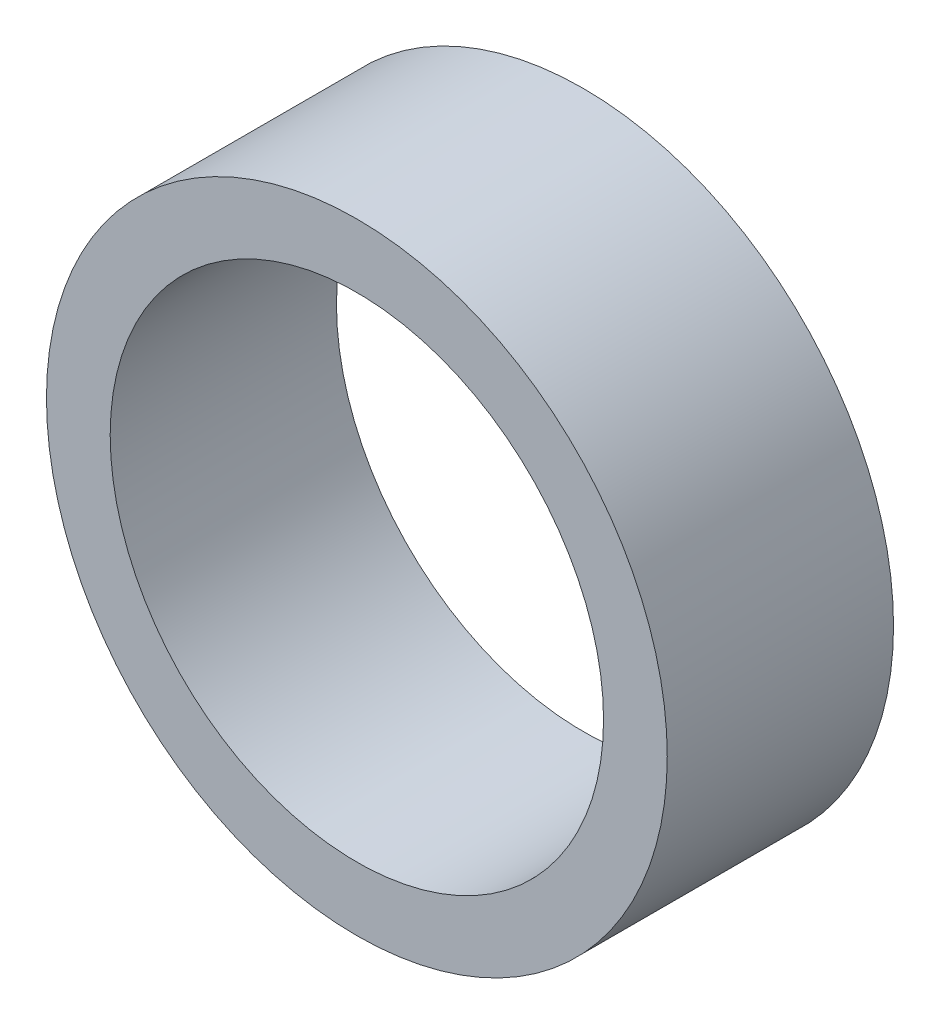
from build123d import *

# Parameters (mm, degrees)
SKETCH1_R           = 19
SKETCH1_R_2         = 15.1
BOSS_EXTRUDE1_DEPTH = 6.925


with BuildPart() as part:
    # Sketch1 → Boss-Extrude1 (new, symmetric)
    with BuildSketch(Plane.XY):
        Circle(SKETCH1_R)
        Circle(SKETCH1_R_2, mode=Mode.SUBTRACT)
    extrude(amount=BOSS_EXTRUDE1_DEPTH, both=True)


solid = part.part
